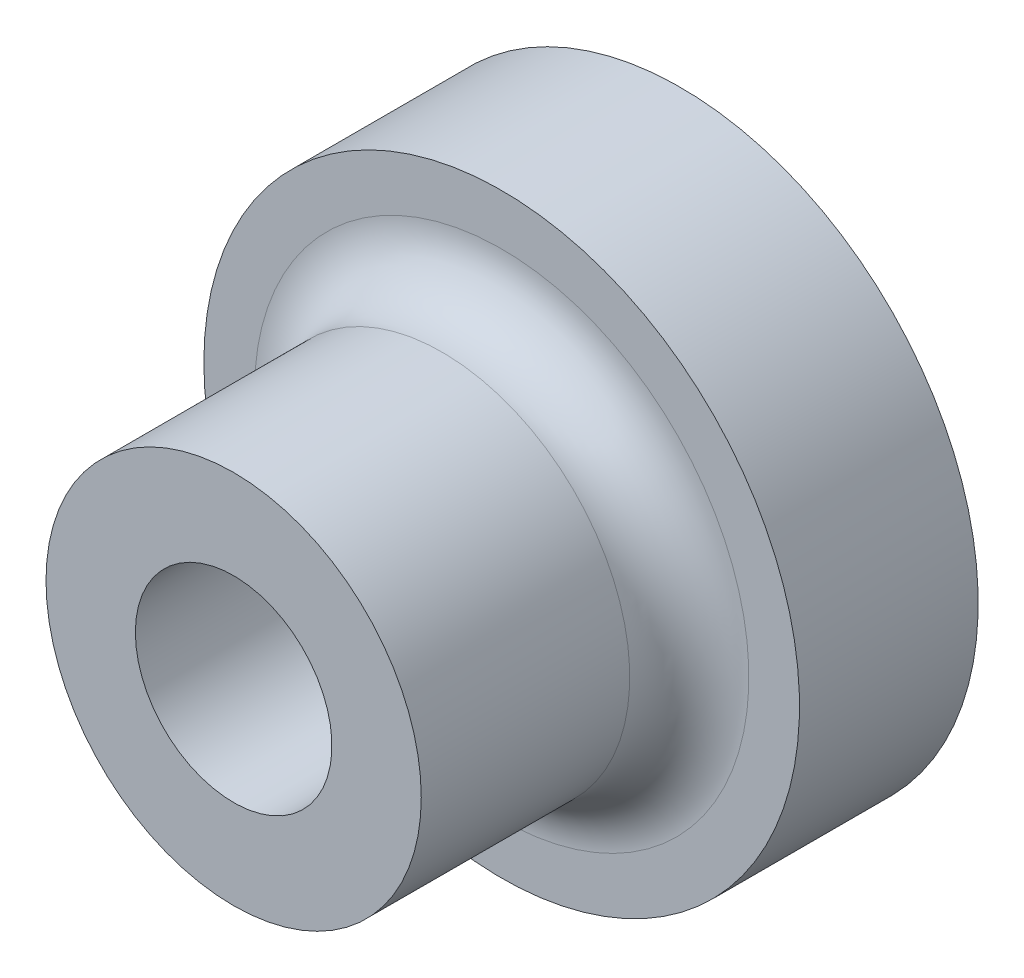
from build123d import *

# Parameters (mm, degrees)
SKETCH1_R           = 3.15
BOSS_EXTRUDE1_DEPTH = 4.5
SKETCH2_R           = 5
BOSS_EXTRUDE2_DEPTH = 3
FILLET1_R           = 1
CUT_EXTRUDE1_REACH  = 12.308
SKETCH3_R           = 1.65


with BuildPart() as part:
    # Sketch1 → Boss-Extrude1 (new body)
    with BuildSketch(Plane.XY):
        Circle(SKETCH1_R)
    extrude(amount=BOSS_EXTRUDE1_DEPTH)

    # Sketch2 → Boss-Extrude2 (add)
    with BuildSketch(Plane(origin=(0, 0, 0), x_dir=(-1, 0, 0), z_dir=(0, 0, -1))):
        Circle(SKETCH2_R)
    extrude(amount=BOSS_EXTRUDE2_DEPTH)

    # Fillet1
    fillet1_edges = [part.edges().sort_by_distance(p)[0] for p in [
        (-3.15, 0, 0),
    ]]
    fillet(fillet1_edges, radius=FILLET1_R)

    # Sketch3 → Cut-Extrude1 (cut, up to next)
    with BuildSketch(Plane(origin=(0, 0, -3), x_dir=(-1, 0, 0), z_dir=(0, 0, -1)), mode=Mode.PRIVATE) as cut_extrude1_sk1:
        Circle(SKETCH3_R)
    cut_extrude1_tool1 = extrude(cut_extrude1_sk1.sketch, amount=-CUT_EXTRUDE1_REACH, mode=Mode.PRIVATE) & part.part
    add(cut_extrude1_tool1.solids().sort_by_distance((0, 0, -3))[0], mode=Mode.SUBTRACT)


solid = part.part
